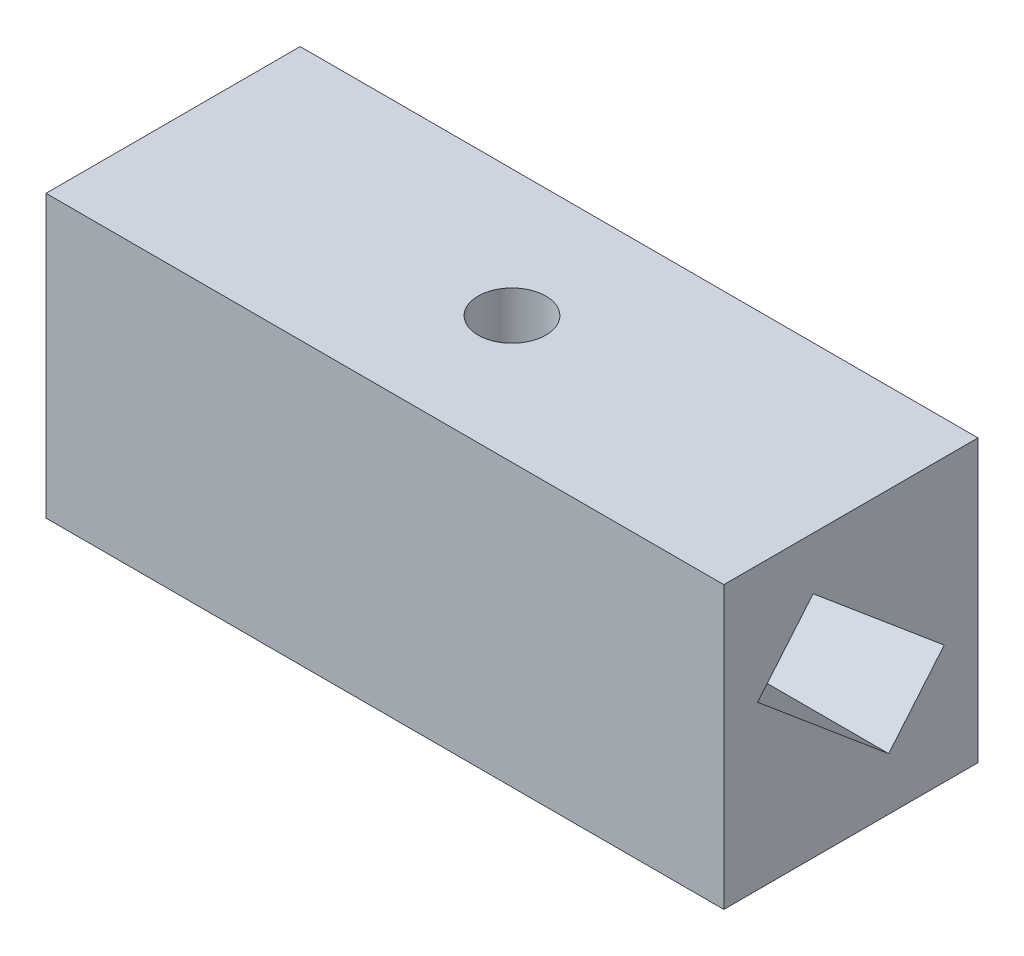
from build123d import *

# Parameters (mm, degrees)
SKETCH_1_W          = 80
SKETCH_1_H          = 30
EXTRUDE_1_DEPTH     = 33.2
SKETCH_2_R          = 4
CUT_EXTRUDE_1_DEPTH = 55.103973976
CUT_EXTRUDE_4_DEPTH = 30
CUT_EXTRUDE_5_DEPTH = 30


with BuildPart() as part:
    # Эскиз1 → Бобышка-Вытянуть1 (new body)
    with BuildSketch(Plane(origin=(0, 0, 0), x_dir=(1, 0, 0), z_dir=(0, 1, 0))):
        Rectangle(SKETCH_1_W, SKETCH_1_H)
    extrude(amount=EXTRUDE_1_DEPTH)

    # Эскиз2 → Вырез-Вытянуть1 (cut, through all)
    with BuildSketch(Plane(origin=(0, 33.2, 0), x_dir=(1, 0, 0), z_dir=(0, 1, 0))):
        with Locations(Location((0, 0, 0), (0, 0, 270))):
            Circle(SKETCH_2_R)
    extrude(amount=-CUT_EXTRUDE_1_DEPTH, mode=Mode.SUBTRACT)

    # Эскиз5 → Вырез-Вытянуть4 (cut)
    with BuildSketch(Plane.ZY.offset(40)):
        Polygon((-11.015265685, 14.014671802), (-4.458832066, 6.201018482), (11.015265685, 19.185328198), (4.458832066, 26.998981518), align=None)
    extrude(amount=-CUT_EXTRUDE_4_DEPTH, mode=Mode.SUBTRACT)

    # Эскиз6 → Вырез-Вытянуть5 (cut)
    with BuildSketch(Plane(origin=(40, 0, 0), x_dir=(0, 0, -1), z_dir=(1, 0, 0))):
        Polygon((11.015265685, 14.014671802), (4.458832066, 6.201018482), (-11.015265685, 19.185328198), (-4.458832066, 26.998981518), align=None)
    extrude(amount=-CUT_EXTRUDE_5_DEPTH, mode=Mode.SUBTRACT)


solid = part.part
